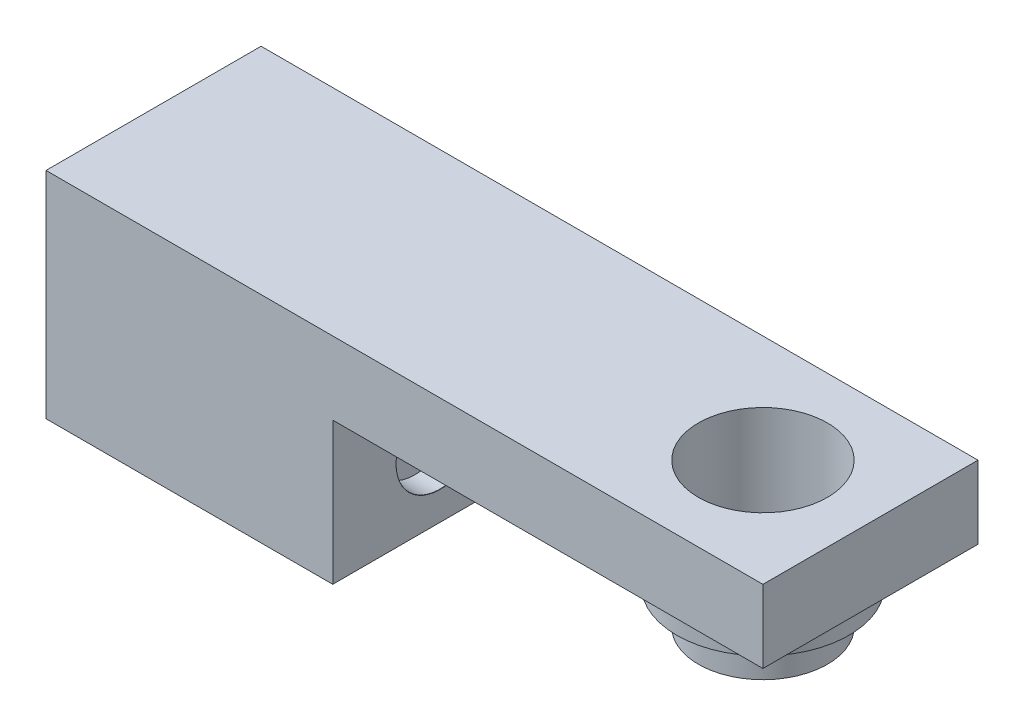
from build123d import *

# Parameters (mm, degrees)
SKETCH_1_W          = 30
SKETCH_1_H          = 30
EXTRUDE_1_DEPTH     = 40
SKETCH_2_W          = 30
SKETCH_2_H          = 10.165772452
EXTRUDE_2_DEPTH     = 60
SKETCH_3_R          = 12
EXTRUDE_3_DEPTH     = 5
SKETCH_4_R          = 9
EXTRUDE_4_DEPTH     = 5
SKETCH_16_R         = 9
CUT_EXTRUDE_1_DEPTH = 15


with BuildPart() as part:
    # Эскиз1 → Бобышка-Вытянуть1 (new body)
    with BuildSketch(Plane(origin=(0, 0, 0), x_dir=(0, 0, -1), z_dir=(1, 0, 0))):
        with Locations((-24.657846844, 7.360988518)):
            Rectangle(SKETCH_1_W, SKETCH_1_H)
    extrude(amount=EXTRUDE_1_DEPTH)

    # Эскиз2 → Бобышка-Вытянуть2 (add)
    with BuildSketch(Plane(origin=(40, 0, 0), x_dir=(0, 0, -1), z_dir=(1, 0, 0))):
        with Locations((-24.657846844, 17.278102292)):
            Rectangle(SKETCH_2_W, SKETCH_2_H)
    extrude(amount=EXTRUDE_2_DEPTH)

    # Эскиз3 → Бобышка-Вытянуть3 (add)
    with BuildSketch(Plane.XZ.offset(-12.195216066)):
        with Locations(Location((85, 24.657846844, 0), (0, 0, 90))):
            Circle(SKETCH_3_R)
    extrude(amount=EXTRUDE_3_DEPTH)

    # Эскиз4 → Бобышка-Вытянуть4 (add)
    with BuildSketch(Plane.XZ.offset(-7.195216066)):
        with Locations(Location((85, 24.657846844, 0), (0, 0, 270))):
            Circle(SKETCH_4_R)
    extrude(amount=EXTRUDE_4_DEPTH)

    # Эскиз13 → Цековка для  болта с шестигранной головкой M51 (revolve, cut)
    with BuildSketch(Plane(origin=(40, 2.482471753, 24.681970174), x_dir=(0, 0, -1), z_dir=(0, 1, 0))):
        Polygon((0, 0), (0, 40), (2.75, 40), (2.75, 3.5), (6.119, 3.5), (6.119, 0.025), (6.144, 0), align=None)
    revolve(axis=Axis((46.35, 2.482471753, 24.681970174), (-1, 0, 0)), mode=Mode.SUBTRACT)

    # Эскиз16 → Вырез-Вытянуть1 (cut)
    with BuildSketch(Plane(origin=(0, 22.360988518, 0), x_dir=(1, 0, 0), z_dir=(0, 1, 0))):
        with Locations(Location((85, -24.657846844, 0), (0, 0, 90))):
            Circle(SKETCH_16_R)
    extrude(amount=-CUT_EXTRUDE_1_DEPTH, mode=Mode.SUBTRACT)


solid = part.part
